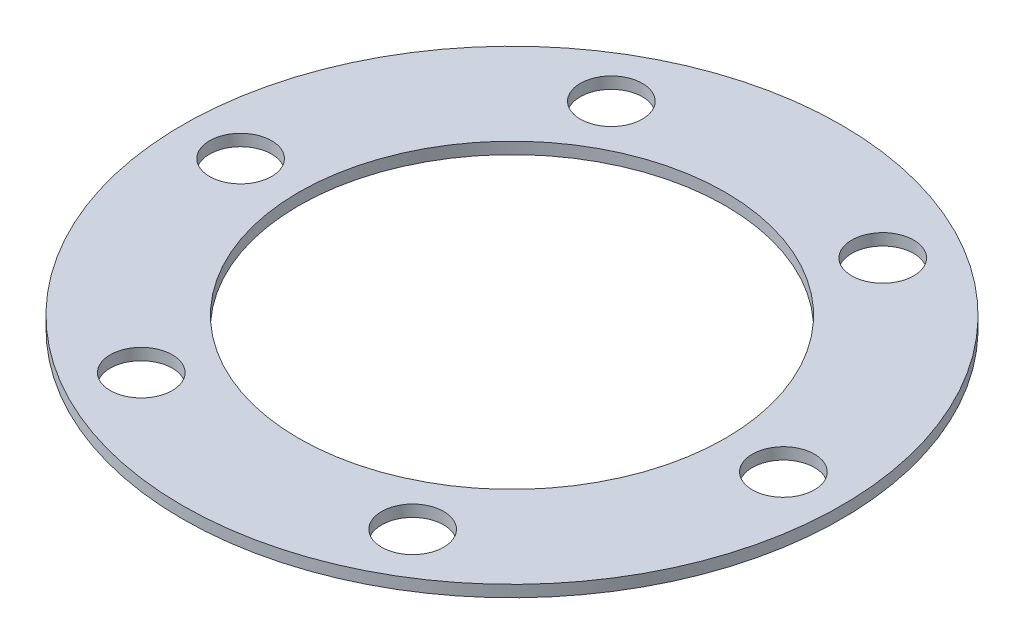
from build123d import *

# Parameters (mm, degrees)
SKETCH1_R               = 85
SKETCH1_R_2             = 55
BOSS_EXTRUDE1_DEPTH     = 1.5
CUT_EXTRUDE1_DEPTH      = 121.245582039
CUT_EXTRUDE1_DEPTH_BACK = 121.245582039
SKETCH2_R               = 8


with BuildPart() as part:
    # Sketch1 → Boss-Extrude1 (new, symmetric)
    with BuildSketch(Plane(origin=(0, 0, 0), x_dir=(1, 0, 0), z_dir=(0, 1, 0))):
        with Locations(Location((0, 0, 0), (0, 0, 270))):
            Circle(SKETCH1_R)
        with Locations(Location((0, 0, 0), (0, 0, 270))):
            Circle(SKETCH1_R_2, mode=Mode.SUBTRACT)
    extrude(amount=BOSS_EXTRUDE1_DEPTH, both=True)

    # Sketch2 → Cut-Extrude1 (cut, two sides: drawn at the far end of the back side and taken through both)
    with BuildSketch(Plane(origin=(0, 1.5, 0), x_dir=(1, 0, 0), z_dir=(0, 1, 0)).offset(-CUT_EXTRUDE1_DEPTH_BACK)):
        with Locations(Location((70, 0, 0), (0, 0, 270))):
            Circle(SKETCH2_R)
        with Locations(Location((35, -60.621778265, 0), (0, 0, 270))):
            Circle(SKETCH2_R)
        with Locations(Location((-35, -60.621778265, 0), (0, 0, 270))):
            Circle(SKETCH2_R)
        with Locations(Location((-70, 0, 0), (0, 0, 270))):
            Circle(SKETCH2_R)
        with Locations(Location((-35, 60.621778265, 0), (0, 0, 270))):
            Circle(SKETCH2_R)
        with Locations(Location((35, 60.621778265, 0), (0, 0, 270))):
            Circle(SKETCH2_R)
    extrude(amount=CUT_EXTRUDE1_DEPTH + CUT_EXTRUDE1_DEPTH_BACK, mode=Mode.SUBTRACT)


solid = part.part
